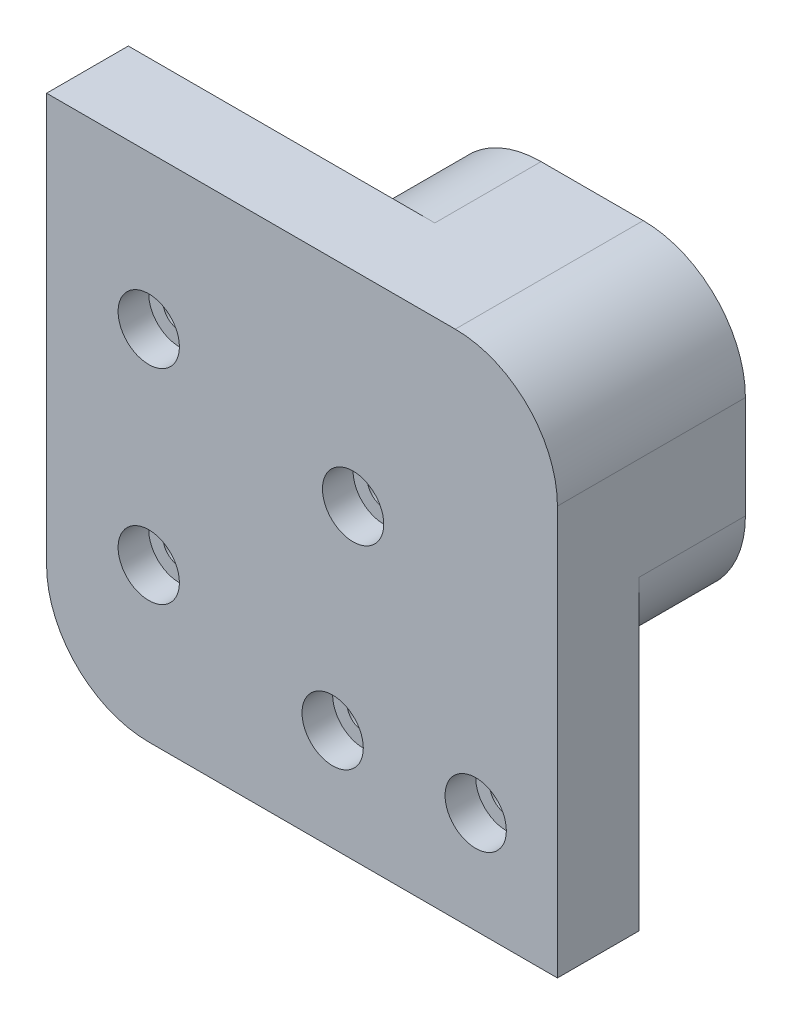
from build123d import *

# Parameters (mm, degrees)
SKETCH_1_R          = 1.6
EXTRUDE_1_DEPTH     = 8
SKETCH_2_R          = 3
CUT_EXTRUDE_1_DEPTH = 3
FILLET_1_R          = 10
SKETCH_3_R          = 1.6
EXTRUDE_2_DEPTH     = 18.3999492
SKETCH_4_R          = 3
CUT_EXTRUDE_2_DEPTH = 3
FILLET_2_R          = 10


with BuildPart() as part:
    # 草图1 → 凸台-拉伸1 (new body)
    with BuildSketch(Plane.XY):
        Polygon((-10, -110), (10, -110), (10, -140.028839027), (40, -140.028839027), (40, -160), (-10, -160), align=None)
        with Locations((0, -125)):
            Circle(SKETCH_1_R, mode=Mode.SUBTRACT)
        with Locations((0, -145)):
            Circle(SKETCH_1_R, mode=Mode.SUBTRACT)
        with Locations((18, -150.014419513)):
            Circle(SKETCH_1_R, mode=Mode.SUBTRACT)
        with Locations((32, -150.014419513)):
            Circle(SKETCH_1_R, mode=Mode.SUBTRACT)
    extrude(amount=EXTRUDE_1_DEPTH)

    # 草图2 → 切除-拉伸1 (cut)
    with BuildSketch(Plane.XY.offset(8)):
        with Locations((32, -150.014419513)):
            Circle(SKETCH_2_R)
        with Locations((18, -150.014419513)):
            Circle(SKETCH_2_R)
        with Locations((0, -145)):
            Circle(SKETCH_2_R)
        with Locations((0, -125)):
            Circle(SKETCH_2_R)
    extrude(amount=-CUT_EXTRUDE_1_DEPTH, mode=Mode.SUBTRACT)

    # 圆角1
    fillet_1_edges = [part.edges().sort_by_distance(p)[0] for p in [
        (10, -140.028839027, 4),
        (-10, -160, 4),
    ]]
    fillet(fillet_1_edges, radius=FILLET_1_R)

    # 草图3 → 凸台-拉伸2 (add)
    with BuildSketch(Plane.XY.offset(8)):
        with BuildLine():
            Line((10, -130.028839027), (10, -110))
            Line((10, -110), (40, -110))
            Line((40, -110), (40, -140.028839027))
            Line((40, -140.028839027), (20, -140.028839027))
            ThreePointArc((20, -140.028839027), (12.928932188, -137.099906839), (10, -130.028839027))
        make_face()
        with Locations((20, -130.028839027)):
            Circle(SKETCH_3_R, mode=Mode.SUBTRACT)
    extrude(amount=-EXTRUDE_2_DEPTH)

    # 草图4 → 切除-拉伸2 (cut)
    with BuildSketch(Plane.XY.offset(8)):
        with Locations((20, -130.028839027)):
            Circle(SKETCH_4_R)
    extrude(amount=-CUT_EXTRUDE_2_DEPTH, mode=Mode.SUBTRACT)

    # 圆角2
    fillet_2_edges = [part.edges().sort_by_distance(p)[0] for p in [
        (40, -140.028839027, -5.1999746),
        (40, -110, -1.1999746),
        (10, -110, -5.1999746),
    ]]
    fillet(fillet_2_edges, radius=FILLET_2_R)


solid = part.part
